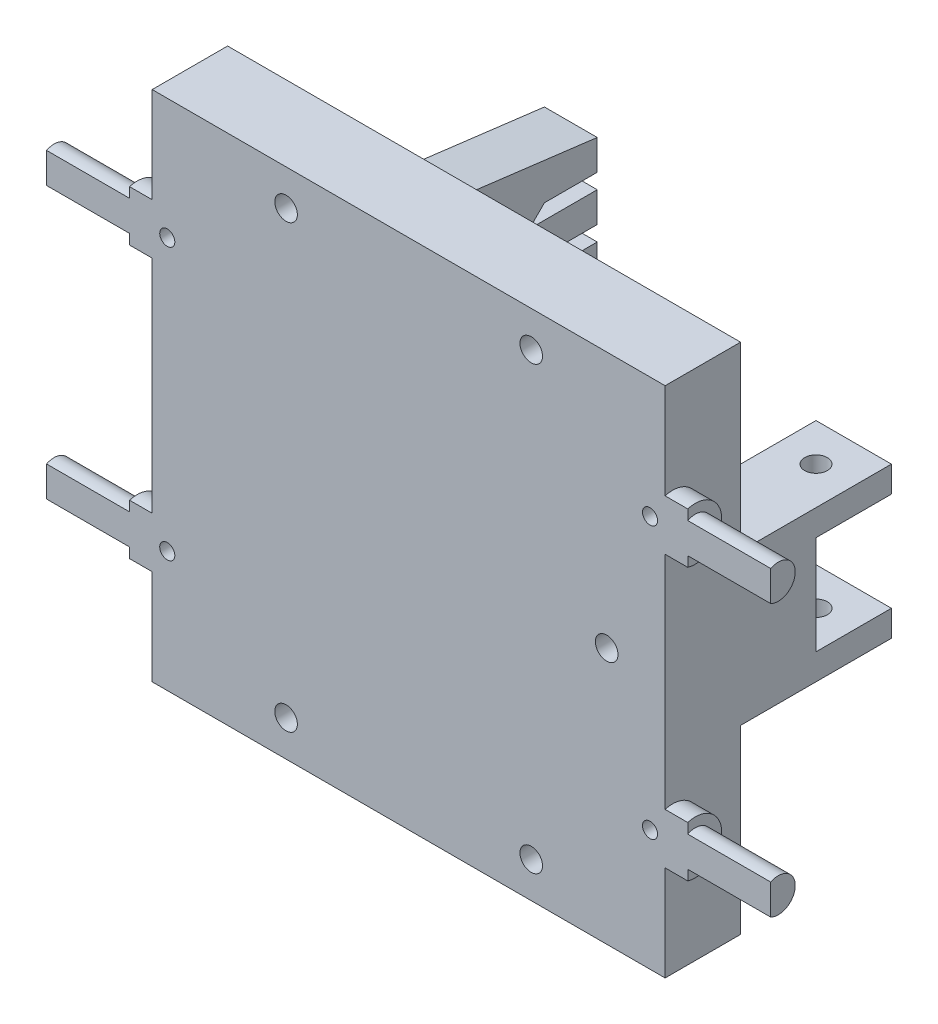
from build123d import *

# Parameters (mm, degrees)
SKETCH1_W           = 68
SKETCH1_H           = 68
BOSS_EXTRUDE1_DEPTH = 10
BOSS_EXTRUDE2_DEPTH = 3
BOSS_EXTRUDE3_DEPTH = 11
BOSS_EXTRUDE4_START = 3
BOSS_EXTRUDE4_DEPTH = 3
BOSS_EXTRUDE5_START = 11
BOSS_EXTRUDE5_DEPTH = 11
SKETCH6_W           = 42.5
SKETCH6_H           = 42.5
CUT_EXTRUDE1_DEPTH  = 3
SKETCH8_R           = 1.5
CUT_EXTRUDE2_DEPTH  = 15
SKETCH9_W           = 10
SKETCH9_H           = 20
BOSS_EXTRUDE6_DEPTH = 20
SKETCH10_R          = 1.5
CUT_EXTRUDE3_DEPTH  = 10
SKETCH11_R          = 1
CUT_EXTRUDE4_DEPTH  = 20
SKETCH13_W          = 7
SKETCH13_H          = 16
BOSS_EXTRUDE7_DEPTH = 40
CUT_EXTRUDE5_DEPTH  = 10
BOSS_EXTRUDE8_START = -7
BOSS_EXTRUDE8_DEPTH = 7
SKETCH17_W          = 10
SKETCH17_H          = 13.1
CUT_EXTRUDE6_DEPTH  = 10
SKETCH18_R          = 1.5
CUT_EXTRUDE7_DEPTH  = 30


with BuildPart() as part:
    # Sketch1 → Boss-Extrude1 (new body)
    with BuildSketch(Plane.XY):
        with Locations((-34, -34)):
            Rectangle(SKETCH1_W, SKETCH1_H)
    extrude(amount=BOSS_EXTRUDE1_DEPTH)

    # Sketch2 → Boss-Extrude2 (add)
    with BuildSketch(Plane.ZY.offset(68)):
        with BuildLine():
            Line((10, -19.354101966), (10, -12.645898034))
            ThreePointArc((10, -12.645898034), (5.5, -16), (10, -19.354101966))
        make_face()
        with BuildLine():
            Line((10, -55.354101966), (10, -48.645898034))
            ThreePointArc((10, -48.645898034), (5.5, -52), (10, -55.354101966))
        make_face()
    extrude(amount=BOSS_EXTRUDE2_DEPTH)

    # Sketch3 → Boss-Extrude3 (add)
    with BuildSketch(Plane.ZY.offset(71)):
        with BuildLine():
            ThreePointArc((10, -49.984435563), (6.75, -52), (10, -54.015564437))
            Line((10, -54.015564437), (10, -49.984435563))
        make_face()
        with BuildLine():
            ThreePointArc((10, -13.984435563), (6.75, -16), (10, -18.015564437))
            Line((10, -18.015564437), (10, -13.984435563))
        make_face()
    extrude(amount=BOSS_EXTRUDE3_DEPTH)

    # Sketch4 → Boss-Extrude4 (add)
    with BuildSketch(Plane(origin=(0, 0, 0), x_dir=(0, 0, -1), z_dir=(1, 0, 0)).offset(BOSS_EXTRUDE4_START)):
        with BuildLine():
            ThreePointArc((-5.5, -16), (-6.908349934, -13.19375696), (-10, -12.645898034))
            Line((-10, -12.645898034), (-10, -19.354101966))
            ThreePointArc((-10, -19.354101966), (-6.908349934, -18.80624304), (-5.5, -16))
        make_face()
        with BuildLine():
            ThreePointArc((-5.5, -52), (-6.908349934, -49.19375696), (-10, -48.645898034))
            Line((-10, -48.645898034), (-10, -55.354101966))
            ThreePointArc((-10, -55.354101966), (-6.908349934, -54.80624304), (-5.5, -52))
        make_face()
    extrude(amount=-BOSS_EXTRUDE4_DEPTH)

    # Sketch5 → Boss-Extrude5 (add)
    with BuildSketch(Plane(origin=(3, 0, 0), x_dir=(0, 0, -1), z_dir=(1, 0, 0)).offset(BOSS_EXTRUDE5_START)):
        with BuildLine():
            ThreePointArc((-6.75, -16), (-7.814145877, -14.087867682), (-10, -13.984435563))
            Line((-10, -13.984435563), (-10, -18.015564437))
            ThreePointArc((-10, -18.015564437), (-7.814145877, -17.912132318), (-6.75, -16))
        make_face()
        with BuildLine():
            ThreePointArc((-6.75, -52), (-7.814145877, -50.087867682), (-10, -49.984435563))
            Line((-10, -49.984435563), (-10, -54.015564437))
            ThreePointArc((-10, -54.015564437), (-7.814145877, -53.912132318), (-6.75, -52))
        make_face()
    extrude(amount=-BOSS_EXTRUDE5_DEPTH)

    # Sketch6 → Cut-Extrude1 (cut)
    with BuildSketch(Plane(origin=(0, 0, 0), x_dir=(-1, 0, 0), z_dir=(0, 0, -1))):
        with Locations((34, -34)):
            Rectangle(SKETCH6_W, SKETCH6_H)
    extrude(amount=-CUT_EXTRUDE1_DEPTH, mode=Mode.SUBTRACT)

    # Sketch8 → Cut-Extrude2 (cut)
    with BuildSketch(Plane(origin=(0, 0, 0), x_dir=(-1, 0, 0), z_dir=(0, 0, -1))):
        with Locations((17.75, -4.75)):
            Circle(SKETCH8_R)
        with Locations((50.25, -4.75)):
            Circle(SKETCH8_R)
        with Locations((50.25, -63.25)):
            Circle(SKETCH8_R)
        with Locations((17.75, -63.25)):
            Circle(SKETCH8_R)
    extrude(amount=-CUT_EXTRUDE2_DEPTH, mode=Mode.SUBTRACT)

    # Sketch9 → Boss-Extrude6 (add)
    with BuildSketch(Plane(origin=(0, 0, 0), x_dir=(-1, 0, 0), z_dir=(0, 0, -1))):
        with Locations((5, -34)):
            Rectangle(SKETCH9_W, SKETCH9_H)
    extrude(amount=BOSS_EXTRUDE6_DEPTH)

    # Sketch10 → Cut-Extrude3 (cut)
    with BuildSketch(Plane(origin=(0, 0, 0), x_dir=(-1, 0, 0), z_dir=(0, 0, -1))):
        with Locations((7.75, -34)):
            Circle(SKETCH10_R)
        with Locations((7.75, -78)):
            Circle(SKETCH10_R)
    extrude(amount=-CUT_EXTRUDE3_DEPTH, mode=Mode.SUBTRACT)

    # Sketch11 → Cut-Extrude4 (cut)
    with BuildSketch(Plane.XY.offset(10)):
        with Locations((-66, -52)):
            Circle(SKETCH11_R)
        with Locations(Location((-66, -16, 0), (0, 0, 180))):
            Circle(SKETCH11_R)
        with Locations(Location((-2, -52, 0), (0, 0, 180))):
            Circle(SKETCH11_R)
        with Locations((-2, -16)):
            Circle(SKETCH11_R)
    extrude(amount=-CUT_EXTRUDE4_DEPTH, mode=Mode.SUBTRACT)

    # Sketch13 → Boss-Extrude7 (add)
    with BuildSketch(Plane(origin=(0, 0, 0), x_dir=(-1, 0, 0), z_dir=(0, 0, -1))):
        with Locations((62.5, -34)):
            Rectangle(SKETCH13_W, SKETCH13_H)
    extrude(amount=BOSS_EXTRUDE7_DEPTH)

    # Sketch15 → Cut-Extrude5 (cut)
    with BuildSketch(Plane.ZY.offset(66)):
        Polygon((-40, -32), (-31, -32), (-33, -30), (-40, -30), align=None)
        Polygon((-40, -38), (-40, -36), (-31, -36), (-33, -38), align=None)
    extrude(amount=-CUT_EXTRUDE5_DEPTH, mode=Mode.SUBTRACT)

    # Sketch16 → Boss-Extrude8 (add)
    with BuildSketch(Plane.ZY.offset(66).offset(BOSS_EXTRUDE8_START)):
        Polygon((0, -26), (-40, -26), (0, -21), align=None)
        Polygon((-40, -42), (0, -47), (0, -42), align=None)
    extrude(amount=BOSS_EXTRUDE8_DEPTH)

    # Sketch17 → Cut-Extrude6 (cut)
    with BuildSketch(Plane(origin=(0, 0, -20), x_dir=(-1, 0, 0), z_dir=(0, 0, -1))):
        with Locations((5, -34)):
            Rectangle(SKETCH17_W, SKETCH17_H)
    extrude(amount=-CUT_EXTRUDE6_DEPTH, mode=Mode.SUBTRACT)

    # Sketch18 → Cut-Extrude7 (cut)
    with BuildSketch(Plane(origin=(0, -44, 0), x_dir=(-1, 0, 0), z_dir=(0, -1, 0))):
        with Locations(Location((5, 15, 0), (0, 0, 180))):
            Circle(SKETCH18_R)
    extrude(amount=-CUT_EXTRUDE7_DEPTH, mode=Mode.SUBTRACT)


solid = part.part
